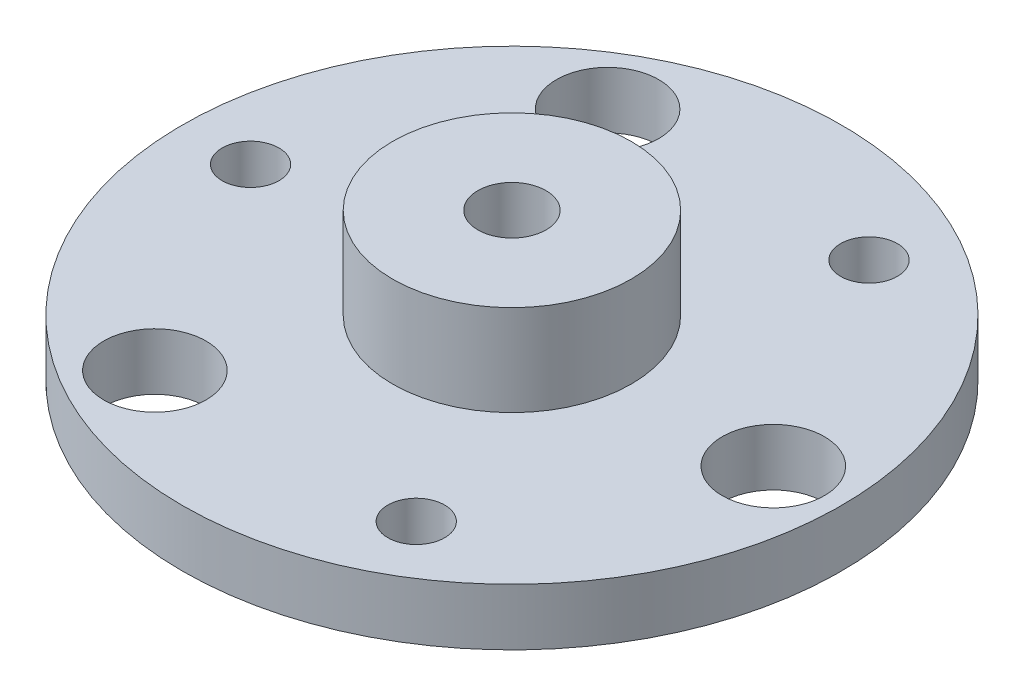
from build123d import *

# Parameters (mm, degrees)
SKETCH1_R           = 29
BOSS_EXTRUDE2_DEPTH = 5
SKETCH3_R           = 10.5
BOSS_EXTRUDE3_DEPTH = 8
SKETCH4_R           = 3
CUT_EXTRUDE1_DEPTH  = 44.023249529
SKETCH6_R           = 10
BOSS_EXTRUDE5_DEPTH = 7
SKETCH8_R           = 3
CUT_EXTRUDE3_DEPTH  = 44.023249529
SKETCH9_R           = 2.5
CUT_EXTRUDE4_DEPTH  = 43.731721238
SKETCH10_R          = 4.5
CUT_EXTRUDE5_DEPTH  = 43.731721238


with BuildPart() as part:
    # Sketch1 → Boss-Extrude2 (new body)
    with BuildSketch(Plane(origin=(0, 0, 0), x_dir=(1, 0, 0), z_dir=(0, 1, 0))):
        with Locations(Location((0, 0, 0), (0, 0, 270))):
            Circle(SKETCH1_R)
    extrude(amount=BOSS_EXTRUDE2_DEPTH)

    # Sketch3 → Boss-Extrude3 (add)
    with BuildSketch(Plane(origin=(0, 5, 0), x_dir=(1, 0, 0), z_dir=(0, 1, 0))):
        with Locations(Location((0, 0, 0), (0, 0, 270))):
            Circle(SKETCH3_R)
    extrude(amount=BOSS_EXTRUDE3_DEPTH)

    # Sketch4 → Cut-Extrude1 (cut, through all)
    with BuildSketch(Plane(origin=(0, 13, 0), x_dir=(1, 0, 0), z_dir=(0, 1, 0))):
        with Locations(Location((0, 0, 0), (0, 0, 270))):
            Circle(SKETCH4_R)
    extrude(amount=-CUT_EXTRUDE1_DEPTH, mode=Mode.SUBTRACT)

    # Sketch6 → Boss-Extrude5 (add)
    with BuildSketch(Plane.XZ):
        with Locations(Location((0, 0, 0), (0, 0, 90))):
            Circle(SKETCH6_R)
    extrude(amount=BOSS_EXTRUDE5_DEPTH)

    # Sketch8 → Cut-Extrude3 (cut, through all)
    with BuildSketch(Plane(origin=(0, 0, 0), x_dir=(1, 0, 0), z_dir=(0, 1, 0))):
        with Locations(Location((0, 0, 0), (0, 0, 270))):
            Circle(SKETCH8_R)
    extrude(amount=-CUT_EXTRUDE3_DEPTH, mode=Mode.SUBTRACT)

    # Sketch9 → Cut-Extrude4 (cut, through all)
    with BuildSketch(Plane(origin=(0, 5, 0), x_dir=(1, 0, 0), z_dir=(0, 1, 0))):
        with Locations(Location((11.5, 19.918584287, 0), (0, 0, 270))):
            Circle(SKETCH9_R)
        with Locations(Location((-23, 0, 0), (0, 0, 270))):
            Circle(SKETCH9_R)
        with Locations(Location((11.5, -19.918584287, 0), (0, 0, 270))):
            Circle(SKETCH9_R)
    extrude(amount=-CUT_EXTRUDE4_DEPTH, mode=Mode.SUBTRACT)

    # Sketch10 → Cut-Extrude5 (cut, through all)
    with BuildSketch(Plane(origin=(0, 5, 0), x_dir=(1, 0, 0), z_dir=(0, 1, 0))):
        with Locations(Location((-11.5, -19.918584287, 0), (0, 0, 270))):
            Circle(SKETCH10_R)
        with Locations(Location((-11.5, 19.918584287, 0), (0, 0, 270))):
            Circle(SKETCH10_R)
        with Locations(Location((23, 0, 0), (0, 0, 270))):
            Circle(SKETCH10_R)
    extrude(amount=-CUT_EXTRUDE5_DEPTH, mode=Mode.SUBTRACT)


solid = part.part
